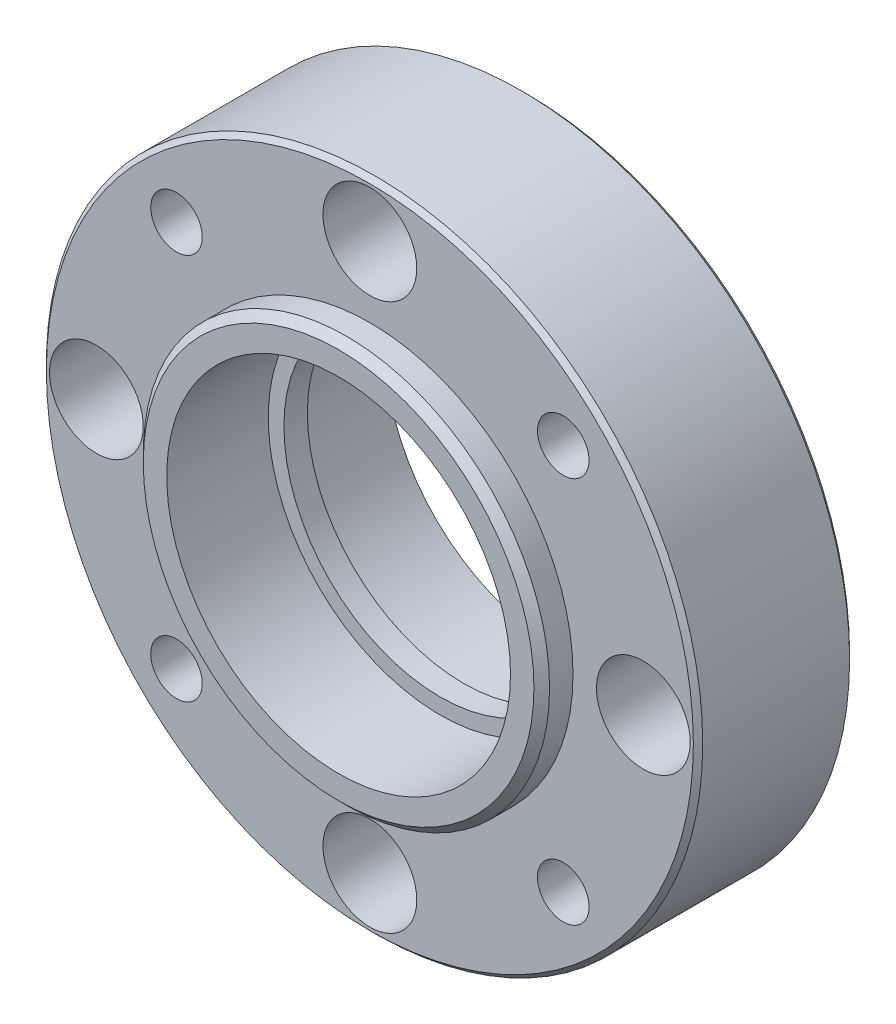
from build123d import *

# Parameters (mm, degrees)
SKETCH_1_W                   = 21
SKETCH_1_H                   = 10
SKETCH_2_R                   = 13.4
EXTRUDE_1_DEPTH              = 2
SKETCH_3_R                   = 13
EXTRUDE_2_DEPTH              = 2
HOLE_WIZARD_M3_1_D           = 3.5
HOLE_WIZARD_M3_1_DEPTH       = 12
HOLE_WIZARD_M3_1_CBORE_D     = 6
HOLE_WIZARD_M3_1_CBORE_DEPTH = 5
HOLE_WIZARD_3_3_3_3_1_D      = 3.3
HOLE_WIZARD_3_3_3_3_1_DEPTH  = 12
CHAMFER_1_SIZE               = 0.3
CHAMFER_2_SIZE               = 0.5


with BuildPart() as part:
    # 草图1 → 旋转1 (revolve)
    with BuildSketch(Plane(origin=(0, 0, 0), x_dir=(1, 0, 0), z_dir=(0, 1, 0))):
        with Locations((10.5, 0)):
            Rectangle(SKETCH_1_W, SKETCH_1_H)
    revolve(axis=Axis((0, 0, -5), (0, 0, 1)))

    # 草图2 → 凸台-拉伸1 (add)
    with BuildSketch(Plane(origin=(0, 0, -5), x_dir=(-1, 0, 0), z_dir=(0, 0, -1))):
        Circle(SKETCH_2_R)
    extrude(amount=EXTRUDE_1_DEPTH)

    # 草图3 → 凸台-拉伸2 (add)
    with BuildSketch(Plane.XY.offset(5)):
        Circle(SKETCH_3_R)
    extrude(amount=EXTRUDE_2_DEPTH)

    # 草图4 → 切除-旋转1 (revolve, cut)
    with BuildSketch(Plane(origin=(0, 0, 0), x_dir=(1, 0, 0), z_dir=(0, 1, 0))):
        Polygon((11, 7), (0, 7), (0, -7), (11, -7), (11, -0.5), (10, -0.5), (10, 1), (11, 1), align=None)
    revolve(axis=Axis((0, 0, -7), (0, 0, 1)), mode=Mode.SUBTRACT)

    # M3 六角头机械螺钉的柱形沉头孔1
    with Locations(Plane.XY.offset(5)):
        with Locations((0, 17.5), (17.5, 0), (0, -17.5), (-17.5, 0)):
            CounterBoreHole(HOLE_WIZARD_M3_1_D / 2, HOLE_WIZARD_M3_1_CBORE_D / 2, HOLE_WIZARD_M3_1_CBORE_DEPTH, depth=HOLE_WIZARD_M3_1_DEPTH)

    # Ø3.3 (3.3) 直径孔1
    with Locations(Plane(origin=(0, 0, -5), x_dir=(-1, 0, 0), z_dir=(0, 0, -1))):
        with Locations((12.374368671, 12.374368671), (-12.374368671, 12.374368671), (-12.374368671, -12.374368671), (12.374368671, -12.374368671)):
            Hole(HOLE_WIZARD_3_3_3_3_1_D / 2, depth=HOLE_WIZARD_3_3_3_3_1_DEPTH)

    # 倒角1
    chamfer_1_edges = [part.edges().sort_by_distance(p)[0] for p in [
        (-21, 0, 5),
        (-21, 0, -5),
    ]]
    chamfer(chamfer_1_edges, length=CHAMFER_1_SIZE)

    # 倒角2
    chamfer_2_edges = [part.edges().sort_by_distance(p)[0] for p in [
        (-13, 0, 7),
        (13.4, 0, -7),
    ]]
    chamfer(chamfer_2_edges, length=CHAMFER_2_SIZE)


solid = part.part
